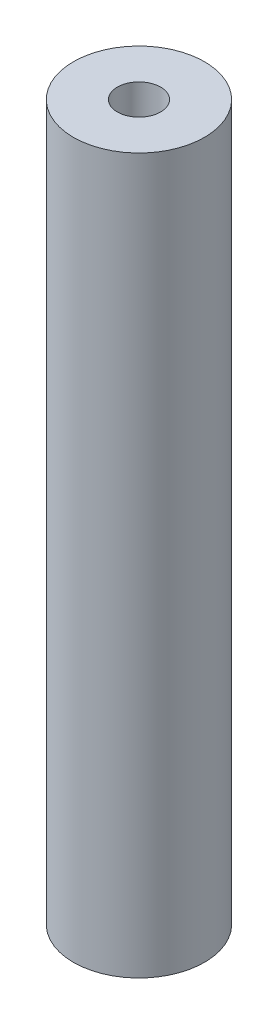
from build123d import *

# Parameters (mm, degrees)
SKETCH_1_R      = 5
EXTRUDE_1_DEPTH = 54.5


with BuildPart() as part:
    # ｽｹｯﾁ1 → ﾎﾞｽ - 押し出し1 (new body)
    with BuildSketch(Plane(origin=(0, 0, 0), x_dir=(1, 0, 0), z_dir=(0, 1, 0))):
        with Locations(Location((0, 0, 0), (0, 0, 270))):
            Circle(SKETCH_1_R)
    extrude(amount=EXTRUDE_1_DEPTH)

    # ｽｹｯﾁ3 → M4x0.7 ねじ穴1 (revolve, cut)
    with BuildSketch(Plane(origin=(0, 54.5, 0), x_dir=(0, 0, 1), z_dir=(1, 0, 0))):
        Polygon((0, 0), (0, 15.991420021), (1.65, 15), (1.65, 0), align=None)
    m4x0_7_1 = revolve(axis=Axis((0, 60.85, 0), (0, -1, 0)), mode=Mode.SUBTRACT)

    # ﾐﾗｰ1: M4x0.7 ねじ穴1 across plane
    add(m4x0_7_1.mirror(Plane.ZX.offset(27.25)), mode=Mode.SUBTRACT)


solid = part.part
